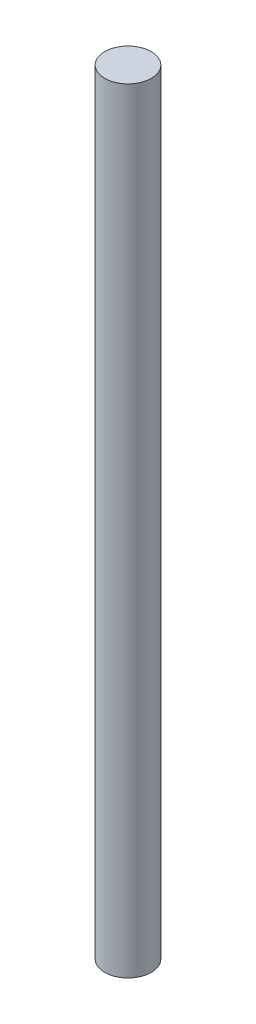
from build123d import *

# Parameters (mm, degrees)
SKETCH1_R           = 7.5
BOSS_EXTRUDE1_DEPTH = 250


with BuildPart() as part:
    # Sketch1 → Boss-Extrude1 (new body)
    with BuildSketch(Plane(origin=(0, 0, 0), x_dir=(1, 0, 0), z_dir=(0, 1, 0))):
        with Locations(Location((0, 0, 0), (0, 0, 270))):
            Circle(SKETCH1_R)
    extrude(amount=BOSS_EXTRUDE1_DEPTH)


solid = part.part
